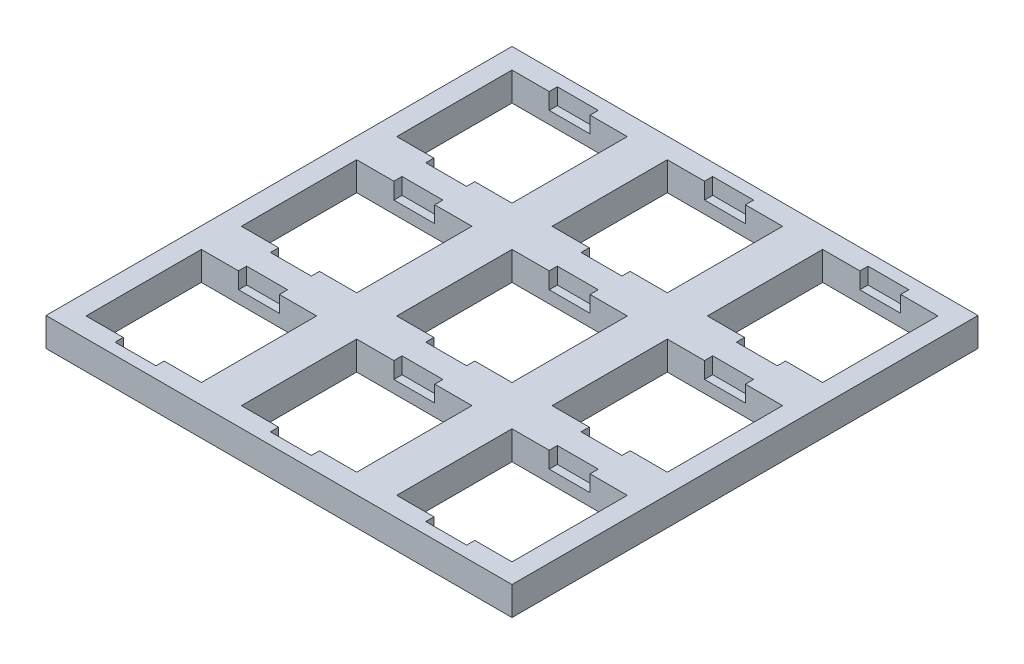
from build123d import *

# Parameters (mm, degrees)
ESQUISSE2_W                     = 57
ESQUISSE2_H                     = 57
BOSS_EXTRU_1_DEPTH              = 3.5
ESQUISSE3_W                     = 14.1
ESQUISSE3_H                     = 14.1
ENL_V_MAT_EXTRU_1_DEPTH         = 3.5
ESQUISSE4_W                     = 5
ESQUISSE4_H                     = 2
ENL_V_MAT_EXTRU_2_DEPTH         = 2
R_P_TITION_LIN_AIRE1_COUNT      = 3
R_P_TITION_LIN_AIRE1_PITCH      = 19
R_P_TITION_LIN_AIRE1_COUNT_DIR2 = 3
R_P_TITION_LIN_AIRE1_PITCH_DIR2 = 19


with BuildPart() as part:
    # Esquisse2 → Boss.-Extru.1 (new body)
    with BuildSketch(Plane(origin=(0, 0, 0), x_dir=(1, 0, 0), z_dir=(0, 1, 0))):
        Rectangle(ESQUISSE2_W, ESQUISSE2_H)
    extrude(amount=BOSS_EXTRU_1_DEPTH)

    # Esquisse3 → Enlèv. mat.-Extru.1 (cut)
    with BuildSketch(Plane(origin=(0, 3.5, 0), x_dir=(1, 0, 0), z_dir=(0, 1, 0))):
        with Locations((-18.95, 18.95)):
            Rectangle(ESQUISSE3_W, ESQUISSE3_H)
    enl_v_mat_extru_1 = extrude(amount=-ENL_V_MAT_EXTRU_1_DEPTH, mode=Mode.SUBTRACT)

    # Esquisse4 → Enlèv. mat.-Extru.2 (cut)
    with BuildSketch(Plane(origin=(0, 3.5, 0), x_dir=(1, 0, 0), z_dir=(0, 1, 0))):
        with Locations((-18.95, 26)):
            Rectangle(ESQUISSE4_W, ESQUISSE4_H)
        with Locations((-18.95, 11.9)):
            Rectangle(ESQUISSE4_W, ESQUISSE4_H)
    enl_v_mat_extru_2 = extrude(amount=-ENL_V_MAT_EXTRU_2_DEPTH, mode=Mode.SUBTRACT)

    # Répétition linéaire1: Enlèv. mat.-Extru.1, Enl_v. mat.-Extru.2 3 × 3
    with Locations(*[(i * R_P_TITION_LIN_AIRE1_PITCH, 0, j * R_P_TITION_LIN_AIRE1_PITCH_DIR2) for i in range(R_P_TITION_LIN_AIRE1_COUNT) for j in range(R_P_TITION_LIN_AIRE1_COUNT_DIR2) if (i, j) != (0, 0)]):
        add(enl_v_mat_extru_1, mode=Mode.SUBTRACT)
        add(enl_v_mat_extru_2, mode=Mode.SUBTRACT)


solid = part.part
